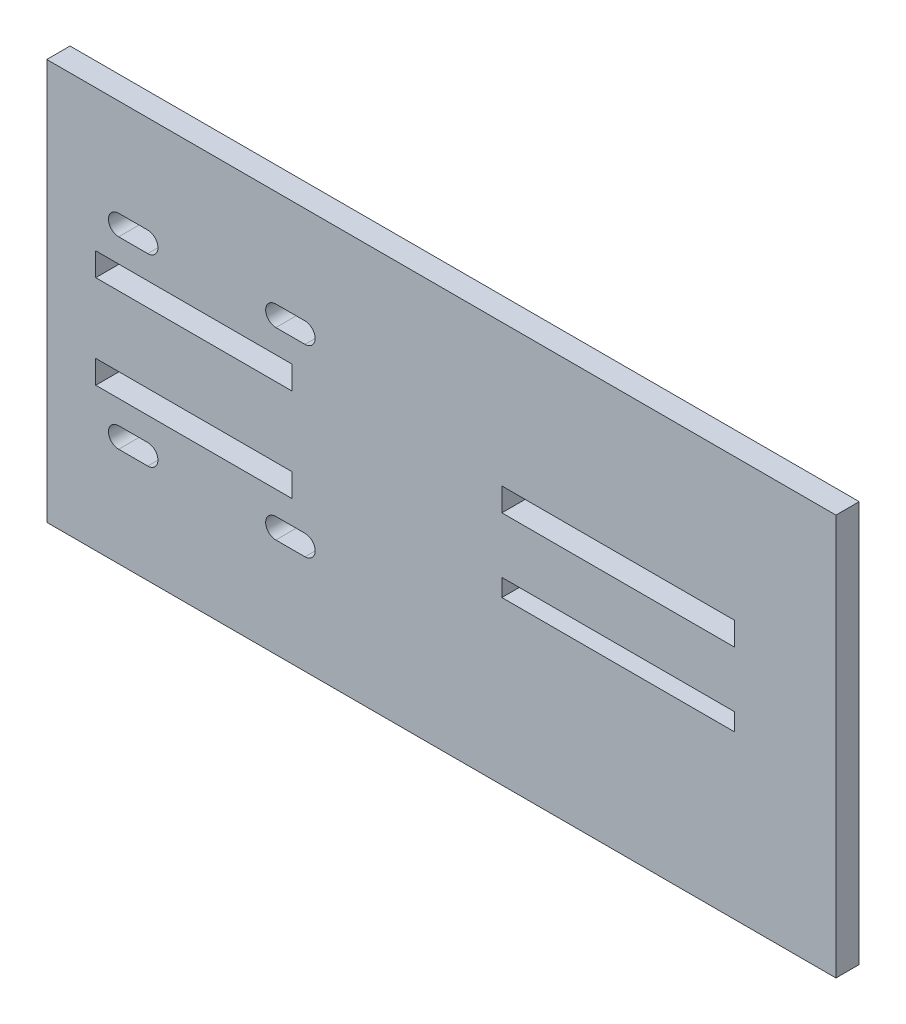
from build123d import *

# Parameters (mm, degrees)
SKETCH_1_W      = 135.554325902
SKETCH_1_H      = 68.857107744
SKETCH_1_W_2    = 33.748913088
SKETCH_1_H_2    = 4
SKETCH_1_W_3    = 40
SKETCH_1_H_3    = 3
EXTRUDE_1_DEPTH = 4


with BuildPart() as part:
    # 草图1 → 凸台-拉伸1 (new body)
    with BuildSketch(Plane.XY):
        with Locations((62.437378831, 12.363507084)):
            Rectangle(SKETCH_1_W, SKETCH_1_H)
        with BuildLine():
            Line((7.008200879, 30.085320336), (12.008200879, 30.085320336))
            ThreePointArc((12.008200879, 30.085320336), (13.758200879, 28.335320336), (12.008200879, 26.585320336))
            Line((12.008200879, 26.585320336), (7.008200879, 26.585320336))
            ThreePointArc((7.008200879, 26.585320336), (5.258200879, 28.335320336), (7.008200879, 30.085320336))
        make_face(mode=Mode.SUBTRACT)
        with BuildLine():
            Line((39.008200879, 26.585320336), (34.008200879, 26.585320336))
            ThreePointArc((34.008200879, 26.585320336), (32.258200879, 28.335320336), (34.008200879, 30.085320336))
            Line((34.008200879, 30.085320336), (39.008200879, 30.085320336))
            ThreePointArc((39.008200879, 30.085320336), (40.758200879, 28.335320336), (39.008200879, 26.585320336))
        make_face(mode=Mode.SUBTRACT)
        with BuildLine():
            Line((7.008200879, -1.514679664), (12.008200879, -1.514679664))
            ThreePointArc((12.008200879, -1.514679664), (13.758200879, -3.264679664), (12.008200879, -5.014679664))
            Line((12.008200879, -5.014679664), (7.008200879, -5.014679664))
            ThreePointArc((7.008200879, -5.014679664), (5.258200879, -3.264679664), (7.008200879, -1.514679664))
        make_face(mode=Mode.SUBTRACT)
        with Locations((19.943744335, 20.535320336)):
            Rectangle(SKETCH_1_W_2, SKETCH_1_H_2, mode=Mode.SUBTRACT)
        with BuildLine():
            Line((39.008200879, -5.014679664), (34.008200879, -5.014679664))
            ThreePointArc((34.008200879, -5.014679664), (32.258200879, -3.264679664), (34.008200879, -1.514679664))
            Line((34.008200879, -1.514679664), (39.008200879, -1.514679664))
            ThreePointArc((39.008200879, -1.514679664), (40.758200879, -3.264679664), (39.008200879, -5.014679664))
        make_face(mode=Mode.SUBTRACT)
        with Locations((19.943744335, 4.535320336)):
            Rectangle(SKETCH_1_W_2, SKETCH_1_H_2, mode=Mode.SUBTRACT)
        with Locations((92.829401098, 20.435320336)):
            Rectangle(SKETCH_1_W_3, SKETCH_1_H_2, mode=Mode.SUBTRACT)
        with Locations((92.829401098, 7.335320336)):
            Rectangle(SKETCH_1_W_3, SKETCH_1_H_3, mode=Mode.SUBTRACT)
    extrude(amount=EXTRUDE_1_DEPTH)


solid = part.part
